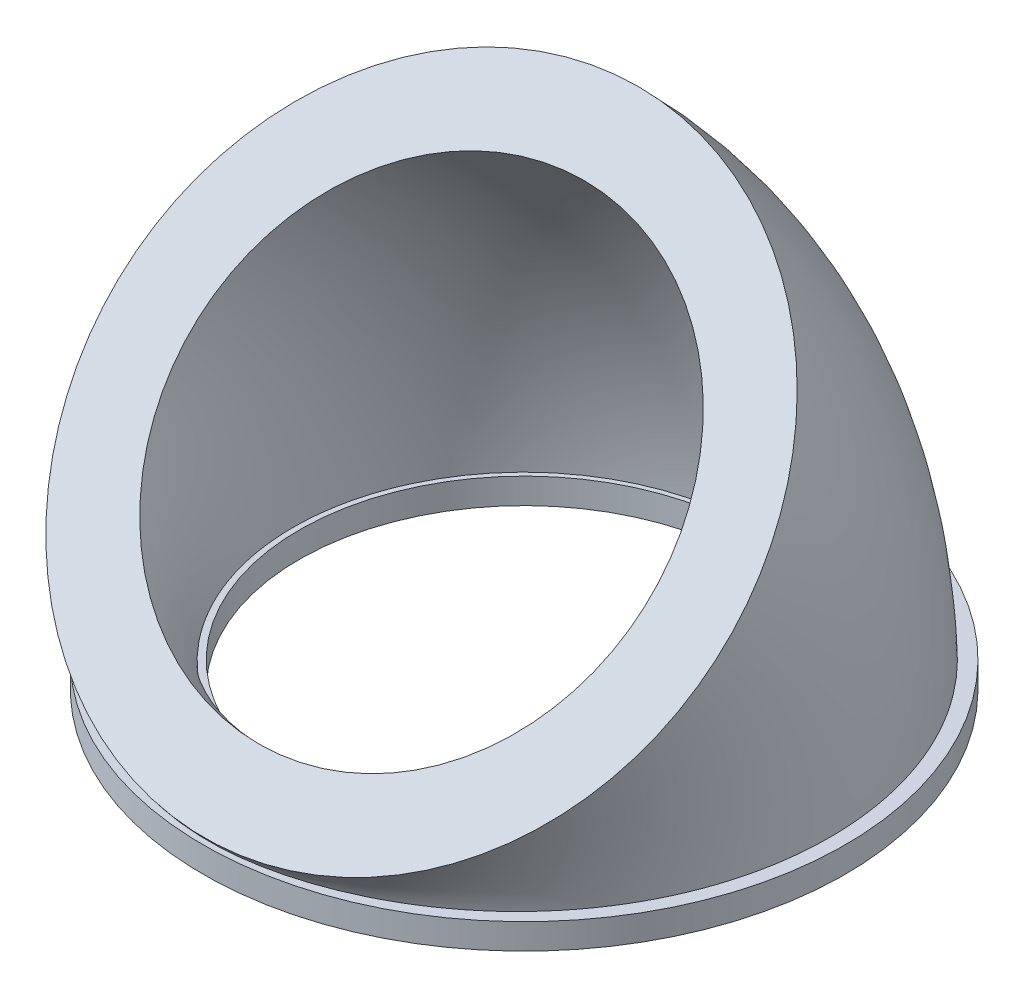
from build123d import *

# Parameters (mm, degrees)
SKETCH1_R               = 24
SKETCH1_R_2             = 18
CUT_EXTRUDE1_DEPTH      = 75.38952556
CUT_EXTRUDE1_DEPTH_BACK = 75.38952556
SKETCH4_R               = 25.108714005
SKETCH4_R_2             = 17.589295803
BOSS_EXTRUDE2_DEPTH     = 2


with BuildPart() as part:
    # Sweep1: sweep along a path in Sketch2
    with BuildLine(Plane(origin=(0, 0, 0), x_dir=(0, 0, -1), z_dir=(1, 0, 0))) as sweep1_path:
        Line((0, 0), (10, 0))
        ThreePointArc((10, 0), (29.391260893, -8.032123253), (37.423384146, -27.423384146))
        Line((37.423384146, -27.423384146), (37.423384146, -34.423384146))
    # Sketch1 → Sweep1 (sweep)
    with BuildSketch(Plane.XY):
        Circle(SKETCH1_R)
        Circle(SKETCH1_R_2, mode=Mode.SUBTRACT)
    sweep(path=sweep1_path.line)

    # Sketch3 → Cut-Extrude1 (cut, two sides: drawn at the far end of the back side and taken through both)
    with BuildSketch(Plane(origin=(0, 0, 0), x_dir=(0, 0, -1), z_dir=(1, 0, 0)).offset(-CUT_EXTRUDE1_DEPTH_BACK)):
        Polygon((-2.958156398, 64.756445855), (-4.559022853, -41.982406999), (10, -27.423384146), (49.610836801, 12.187452656), align=None)
        Polygon((82.756453971, -43.291962181), (-4.559022853, -41.982406999), (10, -27.423384146), (61.423384146, -27.423384146), (82.756453971, -20.958164514), align=None)
    extrude(amount=CUT_EXTRUDE1_DEPTH + CUT_EXTRUDE1_DEPTH_BACK, mode=Mode.SUBTRACT)

    # Sketch4 → Boss-Extrude2 (add)
    with BuildSketch(Plane(origin=(0, -27.423384146, 0), x_dir=(-1, 0, 0), z_dir=(0, -1, 0))):
        with Locations(Location((0, 37.423384146, 0), (0, 0, 90))):
            Circle(SKETCH4_R)
        with Locations(Location((0, 37.423384146, 0), (0, 0, 90))):
            Circle(SKETCH4_R_2, mode=Mode.SUBTRACT)
    extrude(amount=-BOSS_EXTRUDE2_DEPTH)


solid = part.part
